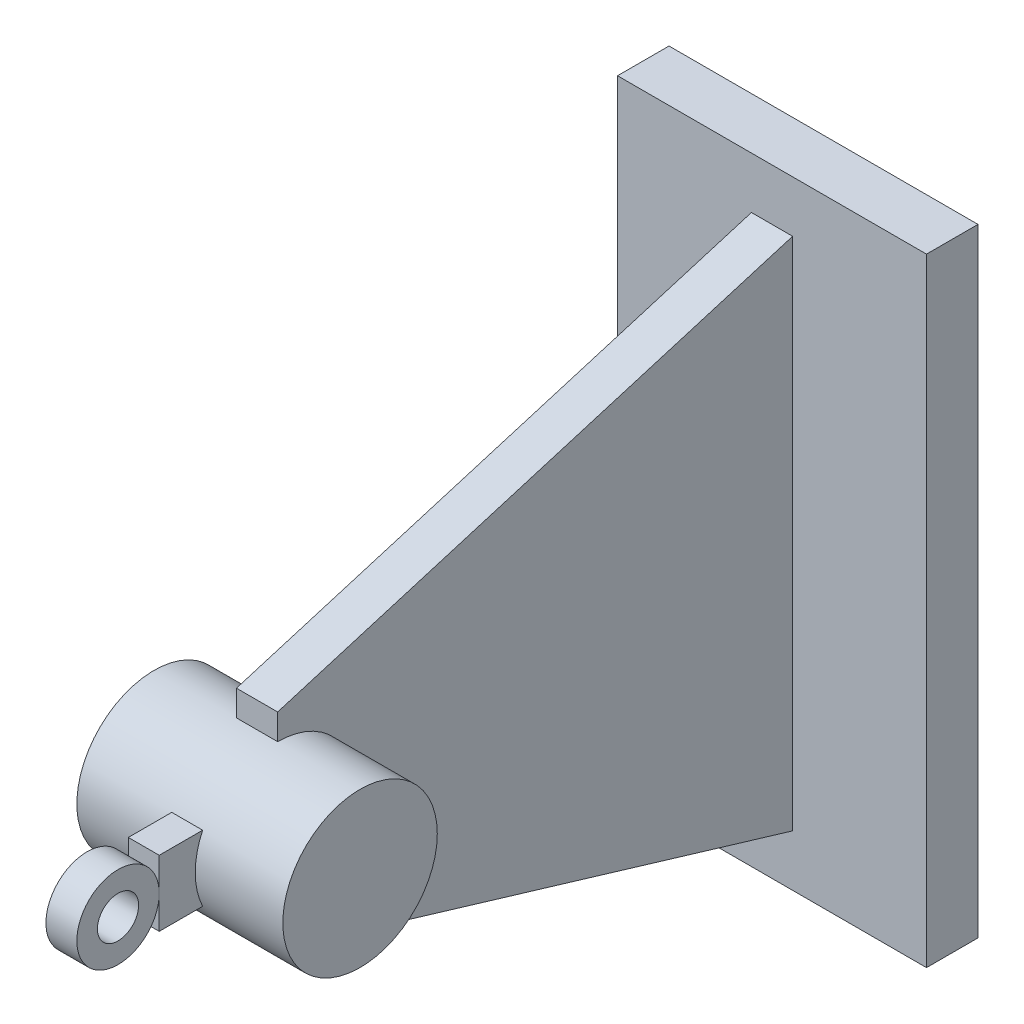
from build123d import *

# Parameters (mm, degrees)
BASE_PLATE_SKETCH_W         = 152.4
BASE_PLATE_SKETCH_H         = 76.2
BASE_PLATE_DEPTH            = 12.7
A_FRAME_BODY_DEPTH          = 5.08
A_FRAME_BODY_DEPTH_BACK     = 5.08
BEARING_HOUSING_DEPTH       = 25.4
BEARING_HOUSING_DEPTH_BACK  = 25.4
BEARING_HOUSING_SKETCH_R    = 19.05
LIFTING_EYELET_DEPTH        = 3.81
LIFTING_EYELET_DEPTH_BACK   = 3.81
LIFTING_EYELET_SKETCH_R     = 10.16
LIFTING_EYELET_SKETCH_R_2   = 5.08
EYELET_CONNECTOR_DEPTH      = 3.81
EYELET_CONNECTOR_DEPTH_BACK = 3.81
EYELET_CONNECTOR_SKETCH_W   = 16.256
EYELET_CONNECTOR_SKETCH_H   = 17.78


with BuildPart() as part:
    # Base Plate Sketch → Base Plate (new body)
    with BuildSketch(Plane(origin=(0, 0, 0), x_dir=(0, 1, 0), z_dir=(0, 0, 1))):
        Rectangle(BASE_PLATE_SKETCH_W, BASE_PLATE_SKETCH_H)
    extrude(amount=-BASE_PLATE_DEPTH)

    # A-Frame Sketch → A-Frame Body (add, two sides: drawn at the far end of the back side and taken through both)
    with BuildSketch(Plane.YZ.offset(-A_FRAME_BODY_DEPTH_BACK)):
        Polygon((-63.5, 0), (63.5, 0), (25.4, 127), (-25.4, 127), align=None)
    extrude(amount=A_FRAME_BODY_DEPTH + A_FRAME_BODY_DEPTH_BACK)

    # Bearing Housing Sketch → Bearing Housing (add, two sides: drawn at the far end of the back side and taken through both)
    with BuildSketch(Plane.YZ.offset(-BEARING_HOUSING_DEPTH_BACK)):
        with Locations(Location((0, 127, 0), (0, 0, 270))):
            Circle(BEARING_HOUSING_SKETCH_R)
    extrude(amount=BEARING_HOUSING_DEPTH + BEARING_HOUSING_DEPTH_BACK)

    # Eyelet Connector Sketch → Eyelet Connector (add, two sides: drawn at the far end of the back side and taken through both)
    with BuildSketch(Plane.YZ.offset(-EYELET_CONNECTOR_DEPTH_BACK)):
        with Locations((0, 146.05)):
            Rectangle(EYELET_CONNECTOR_SKETCH_W, EYELET_CONNECTOR_SKETCH_H)
    extrude(amount=EYELET_CONNECTOR_DEPTH + EYELET_CONNECTOR_DEPTH_BACK)


with BuildPart() as body_2:
    # Lifting Eyelet Sketch → Lifting Eyelet (new, two sides: drawn at the far end of the back side and taken through both)
    with BuildSketch(Plane.YZ.offset(-LIFTING_EYELET_DEPTH_BACK)):
        with Locations(Location((0, 165.1, 0), (0, 0, 270))):
            Circle(LIFTING_EYELET_SKETCH_R)
        with Locations(Location((0, 165.1, 0), (0, 0, 270))):
            Circle(LIFTING_EYELET_SKETCH_R_2, mode=Mode.SUBTRACT)
    extrude(amount=LIFTING_EYELET_DEPTH + LIFTING_EYELET_DEPTH_BACK)


solid = Compound([part.part, body_2.part])
